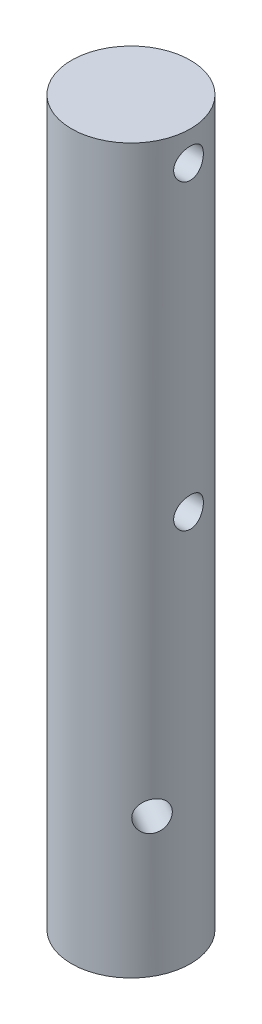
from build123d import *

# Parameters (mm, degrees)
TWELVE_MILLIMETRE_AXLE_STOCK_SKETCH_R = 6
TWELVE_MILLIMETRE_AXLE_STOCK_DEPTH    = 73
FRONT_COLLAR_PIN_SKETCH_R             = 1.5
FRONT_COLLAR_PIN_DEPTH                = 14
REAR_COLLAR_PIN_SKETCH_R              = 1.5
REAR_COLLAR_PIN_DEPTH                 = 14
HUB_DRIVE_PIN_SKETCH_R                = 1.5
HUB_DRIVE_PIN_DEPTH                   = 14


with BuildPart() as part:
    # Twelve millimetre axle stock sketch → Twelve millimetre axle stock (new body)
    with BuildSketch(Plane(origin=(0, -283, 0), x_dir=(1, 0, 0), z_dir=(0, 1, 0))):
        with Locations(Location((-19.009182883, 53.244882879, 0), (0, 0, 270))):
            Circle(TWELVE_MILLIMETRE_AXLE_STOCK_SKETCH_R)
    extrude(amount=TWELVE_MILLIMETRE_AXLE_STOCK_DEPTH)

    # Front collar pin sketch → Front collar pin (cut)
    with BuildSketch(Plane(origin=(-26.009182883, 0, 0), x_dir=(0, 0, -1), z_dir=(1, 0, 0))):
        with Locations(Location((53.244882879, -213, 0), (0, 0, 180))):
            Circle(FRONT_COLLAR_PIN_SKETCH_R)
    extrude(amount=FRONT_COLLAR_PIN_DEPTH, mode=Mode.SUBTRACT)

    # Rear collar pin sketch → Rear collar pin (cut)
    with BuildSketch(Plane(origin=(-26.009182883, 0, 0), x_dir=(0, 0, -1), z_dir=(1, 0, 0))):
        with Locations(Location((53.244882879, -243.5, 0), (0, 0, 180))):
            Circle(REAR_COLLAR_PIN_SKETCH_R)
    extrude(amount=REAR_COLLAR_PIN_DEPTH, mode=Mode.SUBTRACT)

    # Hub drive pin sketch → Hub drive pin (cut)
    with BuildSketch(Plane(origin=(-43.374775586, 0, -25.042438361), x_dir=(0.5000000000000001, 0, -0.8660254037844386), z_dir=(0.8660254037844386, 0, 0.5000000000000001))):
        with Locations(Location((36.606829753, -269, 0), (0, 0, 180))):
            Circle(HUB_DRIVE_PIN_SKETCH_R)
    extrude(amount=HUB_DRIVE_PIN_DEPTH, mode=Mode.SUBTRACT)


solid = part.part
